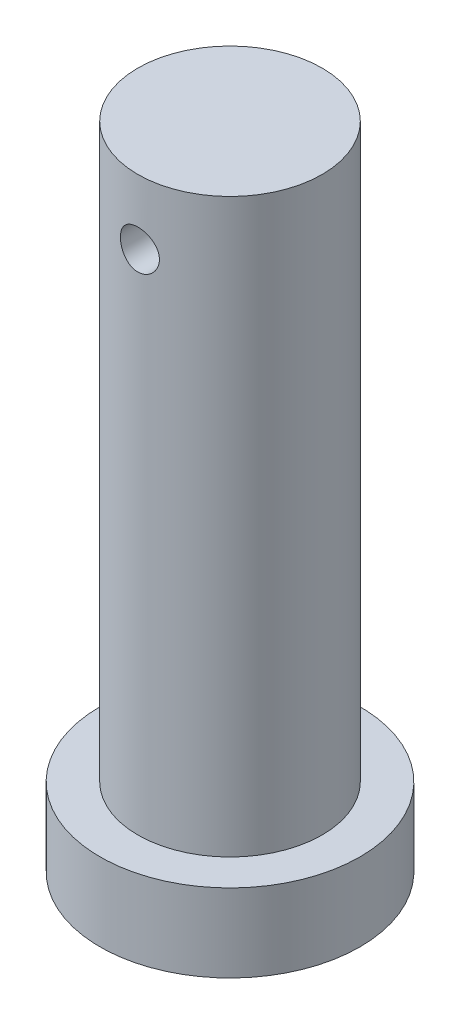
from build123d import *

# Parameters (mm, degrees)
CUT_EXTRUDE1_DEPTH      = 130.903810568
CUT_EXTRUDE1_DEPTH_BACK = 130.903810568
SKETCH3_R               = 3.75


with BuildPart() as part:
    # Sketch2 → Revolve1 (revolve)
    with BuildSketch(Plane.XY, mode=Mode.PRIVATE) as revolve1_sk:
        Polygon((0, 0), (25, 0), (25, 15), (17.7222, 15), (17.7222, 125), (0, 125), align=None)
    revolve(revolve1_sk.sketch.rotate(Axis((0, 125, 0), (0, -1, 0)), 180), axis=Axis((0, 125, 0), (0, -1, 0)))

    # Sketch3 → Cut-Extrude1 (cut, two sides: drawn at the far end of the back side and taken through both)
    with BuildSketch(Plane.XY.offset(-CUT_EXTRUDE1_DEPTH_BACK)):
        with Locations((0, 112.5)):
            Circle(SKETCH3_R)
    extrude(amount=CUT_EXTRUDE1_DEPTH + CUT_EXTRUDE1_DEPTH_BACK, mode=Mode.SUBTRACT)


solid = part.part
